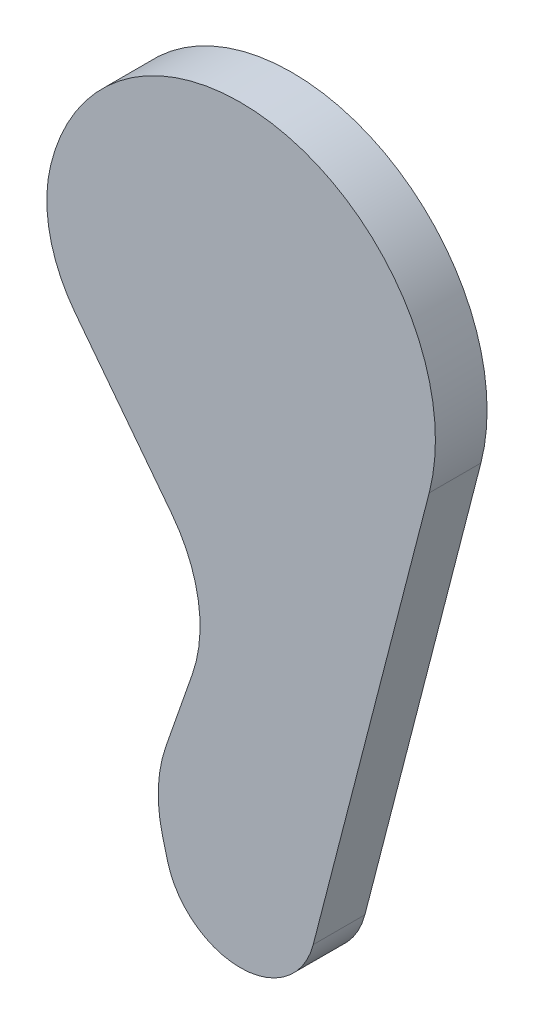
from build123d import *

# Parameters (mm, degrees)
EXTRUDE_1_DEPTH     = 3
CUT_EXTRUDE_1_DEPTH = 10
FILLET_2_R          = 20
EXTRUDE_START       = 4.55
SKETCH_4_R          = 11
SKETCH_4_R_2        = 9
EXTRUDE_2_DEPTH     = 4.55
EXTRUDE_3_DEPTH     = 4.55


with BuildPart() as part:
    # 草图1 → 凸台-拉伸1 (new body)
    with BuildSketch(Plane.XY):
        with BuildLine():
            Line((-27.595006342, -7.125), (-10.650704202, -72.75))
            ThreePointArc((-10.650704202, -72.75), (0, -81), (10.650704202, -72.75))
            Line((10.650704202, -72.75), (27.595006342, -7.125))
            ThreePointArc((27.595006342, -7.125), (0, 28.5), (-27.595006342, -7.125))
        make_face()
    extrude(amount=EXTRUDE_1_DEPTH)

    # 草图2 → 切除-拉伸1 (cut)
    with BuildSketch(Plane.XY.offset(3)):
        Polygon((-12.872325689, -64.14569698), (-3.433026856, -37.146128717), (-28.154763001, -4.957071782), align=None)
    extrude(amount=-CUT_EXTRUDE_1_DEPTH, mode=Mode.SUBTRACT)

    # 圆角2
    fillet_2_edges = [part.edges().sort_by_distance(p)[0] for p in [
        (-12.872325689, -64.14569698, 1.5),
        (-28.03841186, -5.108567351, 1.5),
        (-3.433026856, -37.146128717, 1.5),
    ]]
    fillet(fillet_2_edges, radius=FILLET_2_R)

    # 草图4 → 凸台-拉伸2 (add)
    with BuildSketch(Plane(origin=(0, 0, 0), x_dir=(-1, 0, 0), z_dir=(0, 0, -1)).offset(EXTRUDE_START)):
        with Locations((0, -70)):
            Circle(SKETCH_4_R)
        with Locations((0, -70)):
            Circle(SKETCH_4_R_2, mode=Mode.SUBTRACT)
    extrude(amount=-EXTRUDE_2_DEPTH)

    # 草图5 → 凸台-拉伸3 (add)
    with BuildSketch(Plane(origin=(0, 0, 0), x_dir=(-1, 0, 0), z_dir=(0, 0, -1)).offset(EXTRUDE_START)):
        with BuildLine():
            Line((-10.650704202, -72.75), (-27.595006342, -7.125))
            ThreePointArc((-27.595006342, -7.125), (-6.884619071, 27.655958133), (27.714816001, 6.643716885))
            Line((27.714816001, 6.643716885), (25.769916632, 6.177491138))
            ThreePointArc((25.769916632, 6.177491138), (-6.401487908, 25.715189141), (-25.658514669, -6.625))
            Line((-25.658514669, -6.625), (-10.295351359, -66.126275643))
            ThreePointArc((-10.295351359, -66.126275643), (-10.984204203, -69.410713976), (-10.650704202, -72.75))
        make_face()
    extrude(amount=-EXTRUDE_3_DEPTH)


solid = part.part
